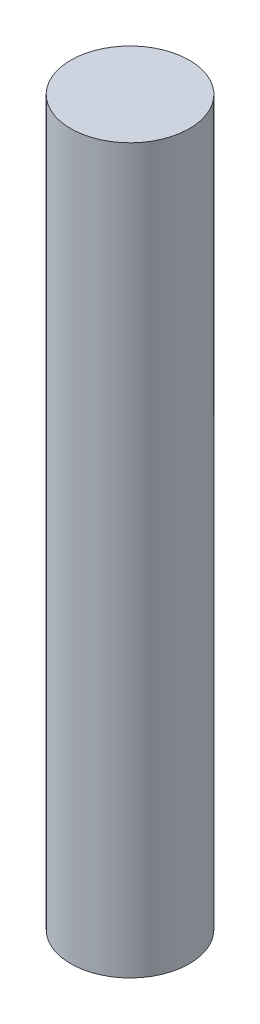
from build123d import *

# Parameters (mm, degrees)
SKETCH1_R           = 2.5
BOSS_EXTRUDE1_DEPTH = 30.48


with BuildPart() as part:
    # Sketch1 → Boss-Extrude1 (new body)
    with BuildSketch(Plane(origin=(0, 0, 0), x_dir=(1, 0, 0), z_dir=(0, 1, 0))):
        with Locations(Location((0, 0, 0), (0, 0, 90))):
            Circle(SKETCH1_R)
    extrude(amount=BOSS_EXTRUDE1_DEPTH)


solid = part.part
